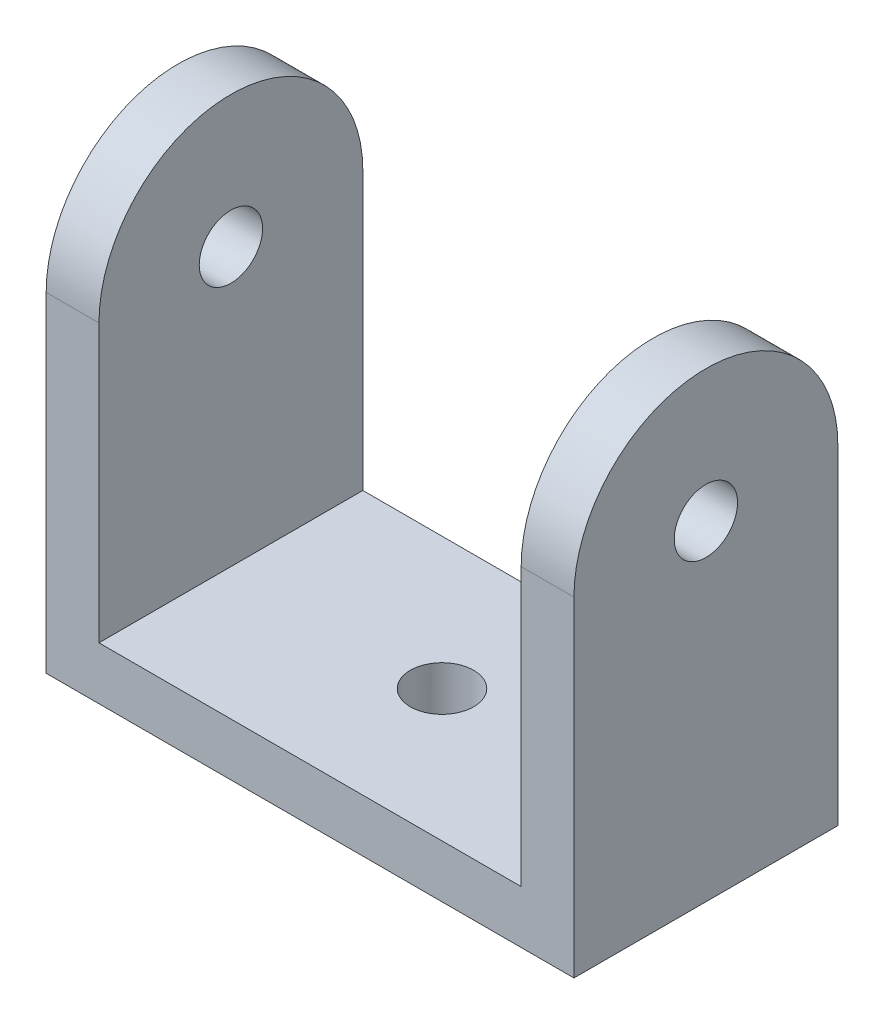
from build123d import *

# Parameters (mm, degrees)
SHOULDER_DEPTH               = 20
SHELL_T                      = -4
SKETCH2_R                    = 2.4
PIVOT_HOLES_DEPTH            = 49.218253805
BASE_MOUNT_REACH             = 43.533
SKETCH4_R                    = 2.4
BASE_MOUNT_DIRECTION_2_DEPTH = 42.533119315


with BuildPart() as part:
    # Sketch1 → shoulder (new, symmetric)
    with BuildSketch(Plane(origin=(0, 0, 0), x_dir=(0, 0, -1), z_dir=(1, 0, 0))):
        with BuildLine():
            Line((10, 0), (10, -25))
            Line((10, -25), (-10, -25))
            Line((-10, -25), (-10, 0))
            ThreePointArc((-10, 0), (0, 10), (10, 0))
        make_face()
    extrude(amount=SHOULDER_DEPTH, both=True)

    # shell
    shell_openings = [part.faces().sort_by_distance(p)[0] for p in [
        (0, -12.5, -10),
        (0, -12.5, 10),
        (0, 10, 0),
    ]]
    offset(amount=SHELL_T, openings=shell_openings, kind=Kind.INTERSECTION)

    # Sketch2 → pivot holes (cut, through all)
    with BuildSketch(Plane(origin=(20, 0, 0), x_dir=(0, 0, -1), z_dir=(1, 0, 0))):
        Circle(SKETCH2_R)
    extrude(amount=-PIVOT_HOLES_DEPTH, mode=Mode.SUBTRACT)

    # Sketch4 → base mount (cut, up to next)
    with BuildSketch(Plane.XZ.offset(25), mode=Mode.PRIVATE) as base_mount_sk1:
        with Locations(Location((0, 0, 0), (0, 0, 90))):
            Circle(SKETCH4_R)
    base_mount_tool1 = extrude(base_mount_sk1.sketch, amount=-BASE_MOUNT_REACH, mode=Mode.PRIVATE) & part.part
    add(base_mount_tool1.solids().sort_by_distance((0, -25, 0))[0], mode=Mode.SUBTRACT)

    # Sketch4 → base mount direction 2 (cut)
    with BuildSketch(Plane.XZ.offset(25)):
        with Locations(Location((0, 0, 0), (0, 0, 90))):
            Circle(SKETCH4_R)
    extrude(amount=BASE_MOUNT_DIRECTION_2_DEPTH, mode=Mode.SUBTRACT)


solid = part.part
